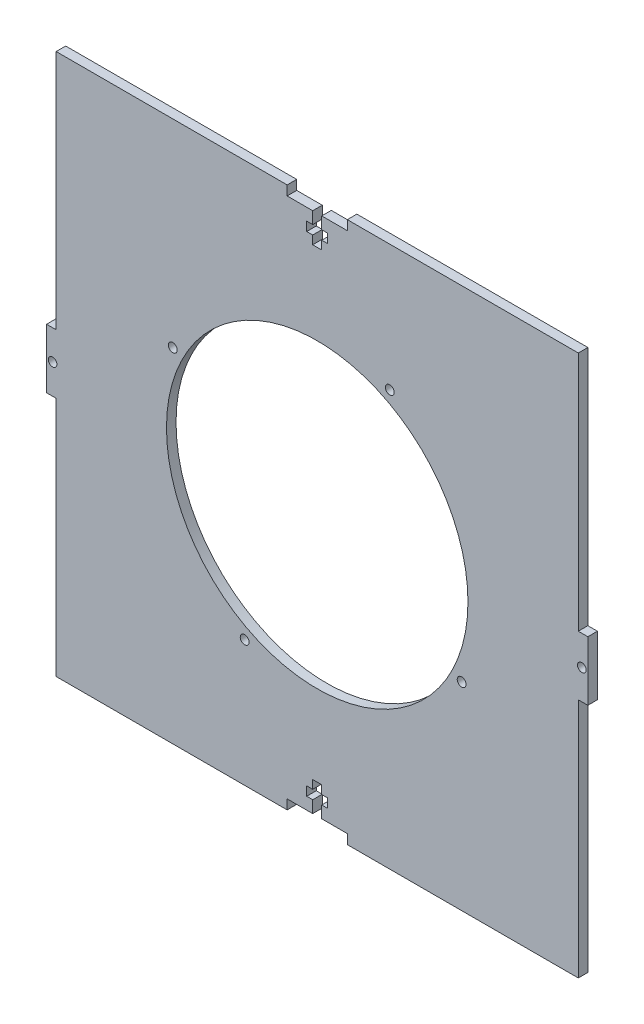
from build123d import *

# Parameters (mm, degrees)
SKETCH3_W           = 180
SKETCH3_H           = 180
SKETCH3_R           = 50.129190947
SKETCH3_R_2         = 1.47
BOSS_EXTRUDE1_DEPTH = 3.18
CUT_EXTRUDE1_DEPTH  = 128.318939675
SKETCH5_R           = 1.436023081
SKETCH5_W           = 3.18
SKETCH5_H           = 80.125
CUT_EXTRUDE2_DEPTH  = 128.318939675


with BuildPart() as part:
    # Sketch3 → Boss-Extrude1 (new body)
    with BuildSketch(Plane.XY):
        Rectangle(SKETCH3_W, SKETCH3_H)
        with Locations(Location((0, 0, 0), (0, 0, 180))):
            Circle(SKETCH3_R, mode=Mode.SUBTRACT)
        with Locations(Location((-48.029419272, 24.129595611, 0), (0, 0, 180))):
            Circle(SKETCH3_R_2, mode=Mode.SUBTRACT)
        with Locations(Location((-24.129595611, -48.029419272, 0), (0, 0, 180))):
            Circle(SKETCH3_R_2, mode=Mode.SUBTRACT)
        with Locations(Location((48.029419272, -24.129595611, 0), (0, 0, 180))):
            Circle(SKETCH3_R_2, mode=Mode.SUBTRACT)
        with Locations(Location((24.129595611, 48.029419272, 0), (0, 0, 180))):
            Circle(SKETCH3_R_2, mode=Mode.SUBTRACT)
    extrude(amount=BOSS_EXTRUDE1_DEPTH)

    # Sketch4 → Cut-Extrude1 (cut, through all)
    with BuildSketch(Plane.XY.offset(3.18)):
        Polygon((1.5, 86.82), (10, 86.82), (10, 90), (-10, 90), (-10, 86.82), (-1.5, 86.82), (-1.5, 82.82), (-3.5, 82.82), (-3.5, 79.82), (-1.5, 79.82), (-1.5, 77), (1.5, 77), (1.5, 79.82), (3.5, 79.82), (3.5, 82.82), (1.5, 82.82), align=None)
        Polygon((1.5, -79.82), (1.5, -77), (-1.5, -77), (-1.5, -79.82), (-3.5, -79.82), (-3.5, -82.82), (-1.5, -82.82), (-1.5, -86.82), (-10, -86.82), (-10, -90), (10, -90), (10, -86.82), (1.5, -86.82), (1.5, -82.82), (3.5, -82.82), (3.5, -79.82), align=None)
    extrude(amount=-CUT_EXTRUDE1_DEPTH, mode=Mode.SUBTRACT)

    # Sketch5 → Cut-Extrude2 (cut, through all)
    with BuildSketch(Plane.XY.offset(3.18)):
        with Locations((-88, 0)):
            Circle(SKETCH5_R)
        with Locations((88, 0)):
            Circle(SKETCH5_R)
        with Locations((-88.41, 49.9375)):
            Rectangle(SKETCH5_W, SKETCH5_H)
        with Locations((-88.41, -49.9375)):
            Rectangle(SKETCH5_W, SKETCH5_H)
        with Locations((88.41, -49.9375)):
            Rectangle(SKETCH5_W, SKETCH5_H)
        with Locations((88.41, 49.9375)):
            Rectangle(SKETCH5_W, SKETCH5_H)
    extrude(amount=-CUT_EXTRUDE2_DEPTH, mode=Mode.SUBTRACT)


solid = part.part
